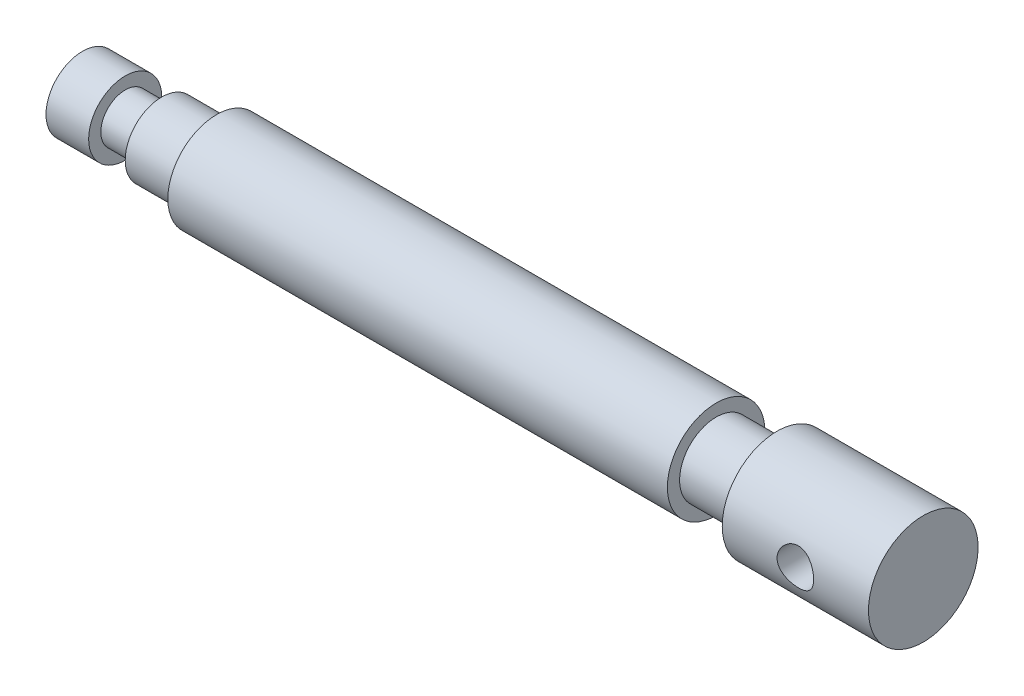
from build123d import *

# Parameters (mm, degrees)
F_6_0_6_DIAMETER_HOLE3_D = 6


with BuildPart() as part:
    # Sketch2 → Revolve1 (revolve)
    with BuildSketch(Plane.XY, mode=Mode.PRIVATE) as revolve1_sk:
        Polygon((0, 0), (0, 6), (7, 6), (7, 4), (13, 4), (13, 6), (22, 6), (22, 8), (104, 8), (104, 6), (114, 6), (114, 9), (138, 9), (138, 0), align=None)
    revolve(revolve1_sk.sketch.rotate(Axis((-23.400708987, 0, 0), (1, 0, 0)), 90), axis=Axis((-23.400708987, 0, 0), (1, 0, 0)))

    # Ø6.0 (6) Diameter Hole3 (through all)
    with Locations(Plane(origin=(126, -0.055998683, 8.999825784), x_dir=(0, 0.999980642698, 0.006222075891), z_dir=(0, -0.006222075891, 0.999980642698))):
        with Locations((0, 0)):
            Hole(F_6_0_6_DIAMETER_HOLE3_D / 2)


solid = part.part
